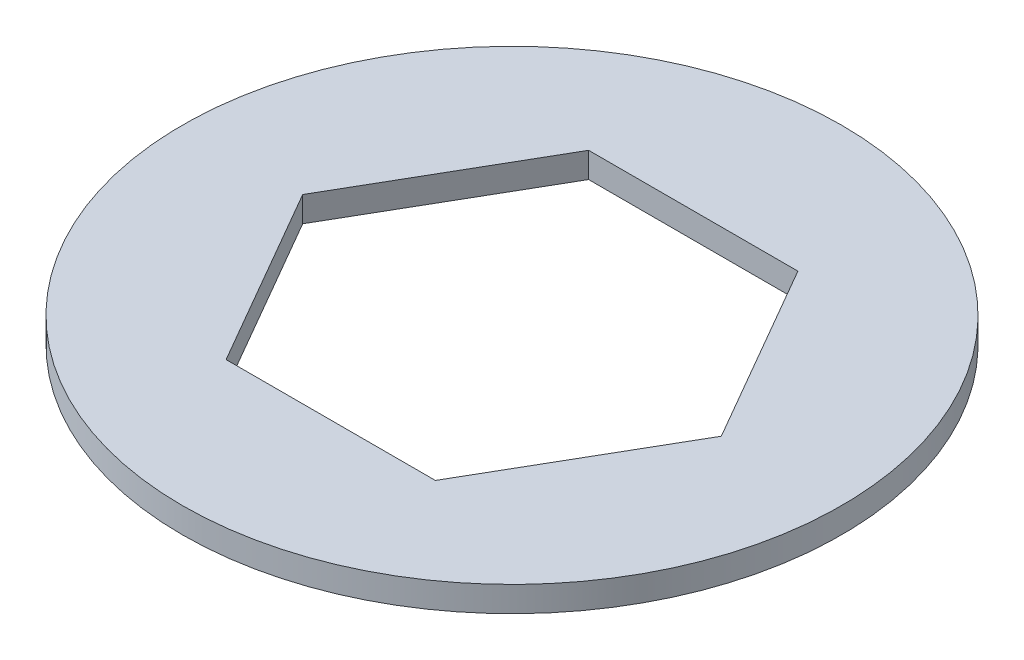
from build123d import *

# Parameters (mm, degrees)
SKIZZE1_R                       = 65
AUFSATZ_LINEAR_AUSTRAGEN1_DEPTH = 5


with BuildPart() as part:
    # Skizze1 → Aufsatz-Linear austragen1 (new body)
    with BuildSketch(Plane(origin=(0, 0, 0), x_dir=(1, 0, 0), z_dir=(0, 1, 0))):
        with Locations(Location((0, 0, 0), (0, 0, 270))):
            Circle(SKIZZE1_R)
        Polygon((41.280544247, 0), (20.640272124, 35.75), (-20.640272124, 35.75), (-41.280544247, 0), (-20.640272124, -35.75), (20.640272124, -35.75), align=None, mode=Mode.SUBTRACT)
    extrude(amount=AUFSATZ_LINEAR_AUSTRAGEN1_DEPTH)


solid = part.part
